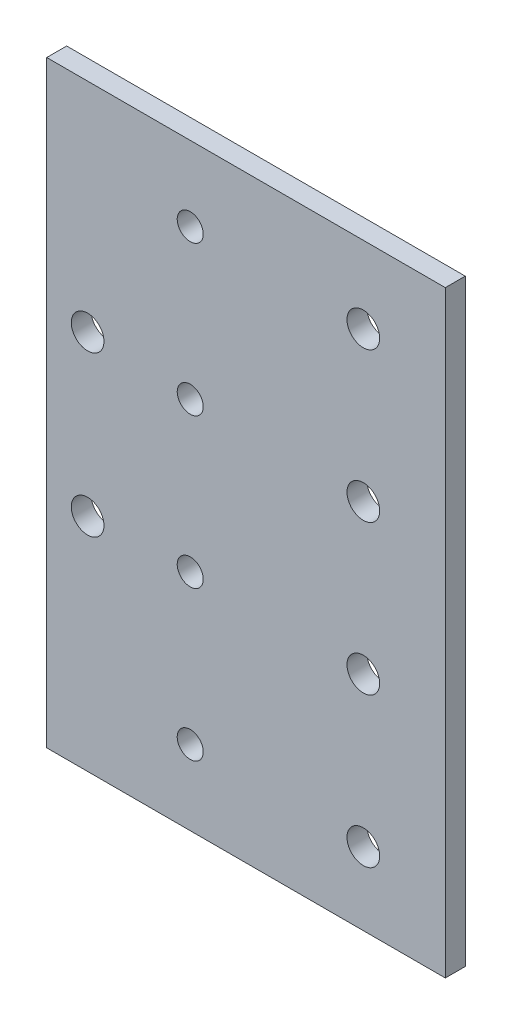
from build123d import *

# Parameters (mm, degrees)
SKETCH2_W           = 100
SKETCH2_H           = 150
BOSS_EXTRUDE1_DEPTH = 5
SKETCH3_R           = 4.1021
CUT_EXTRUDE1_DEPTH  = 5
SKETCH6_R           = 3.2639
CUT_EXTRUDE2_DEPTH  = 269.528430204


with BuildPart() as part:
    # Sketch2 → Boss-Extrude1 (new body)
    with BuildSketch(Plane.XY):
        with Locations((-173.010889244, -74.49468588)):
            Rectangle(SKETCH2_W, SKETCH2_H)
    extrude(amount=BOSS_EXTRUDE1_DEPTH)

    # Sketch3 → Cut-Extrude1 (cut)
    with BuildSketch(Plane(origin=(0, 0, 0), x_dir=(-1, 0, 0), z_dir=(0, 0, -1))):
        with Locations((212.756022811, -54.012878845)):
            Circle(SKETCH3_R)
        with Locations((212.756022811, -94.012878845)):
            Circle(SKETCH3_R)
        with Locations((143.584758496, -18.75)):
            Circle(SKETCH3_R)
        with Locations((143.584758496, -56.25)):
            Circle(SKETCH3_R)
        with Locations((143.584758496, -93.75)):
            Circle(SKETCH3_R)
        with Locations((143.584758496, -131.25)):
            Circle(SKETCH3_R)
    extrude(amount=-CUT_EXTRUDE1_DEPTH, mode=Mode.SUBTRACT)

    # Sketch6 → Cut-Extrude2 (cut, through all)
    with BuildSketch(Plane.XY.offset(5)):
        with Locations((-187.010889244, -18.24468588)):
            Circle(SKETCH6_R)
        with Locations((-187.010889244, -55.74468588)):
            Circle(SKETCH6_R)
        with Locations((-187.010889244, -93.24468588)):
            Circle(SKETCH6_R)
        with Locations((-187.010889244, -130.74468588)):
            Circle(SKETCH6_R)
    extrude(amount=-CUT_EXTRUDE2_DEPTH, mode=Mode.SUBTRACT)


solid = part.part
